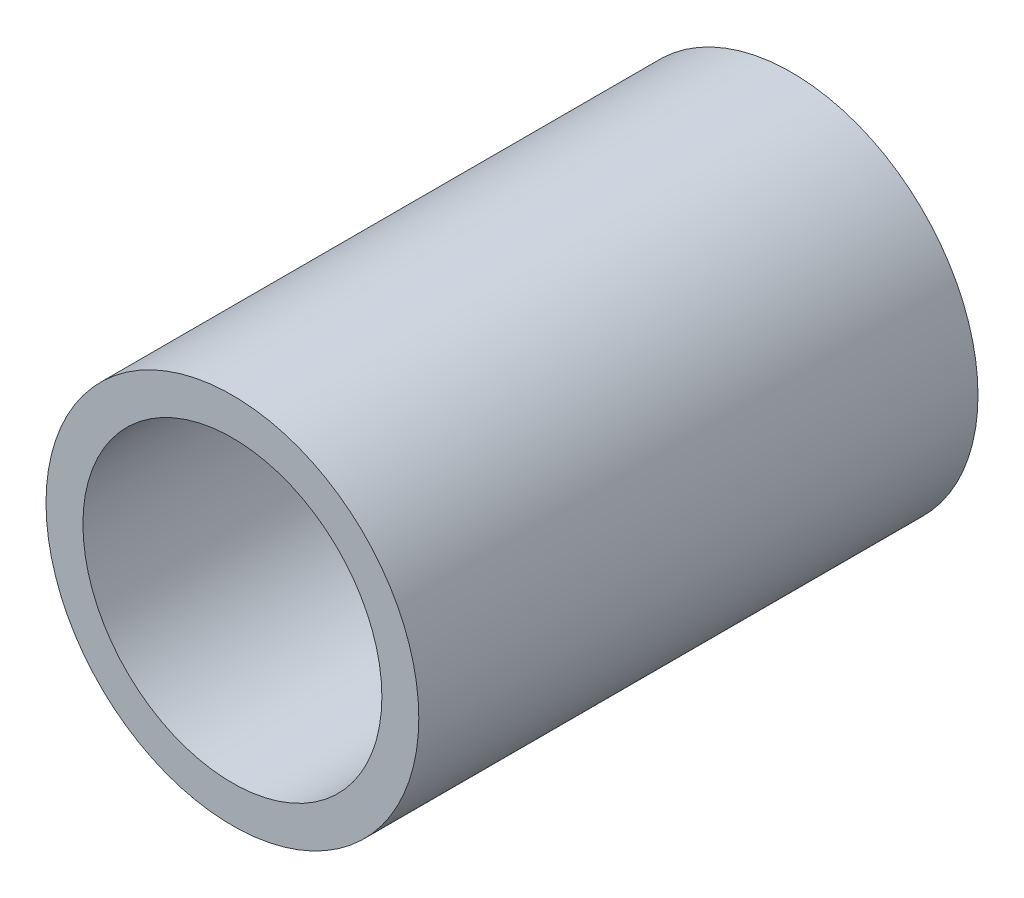
from build123d import *

# Parameters (mm, degrees)
SKETCH1_R    = 5
SKETCH1_R_2  = 4.01
SLEEVE_DEPTH = 15


with BuildPart() as part:
    # Sketch1 → Sleeve (new body)
    with BuildSketch(Plane.XY):
        Circle(SKETCH1_R)
        Circle(SKETCH1_R_2, mode=Mode.SUBTRACT)
    extrude(amount=SLEEVE_DEPTH)


solid = part.part
